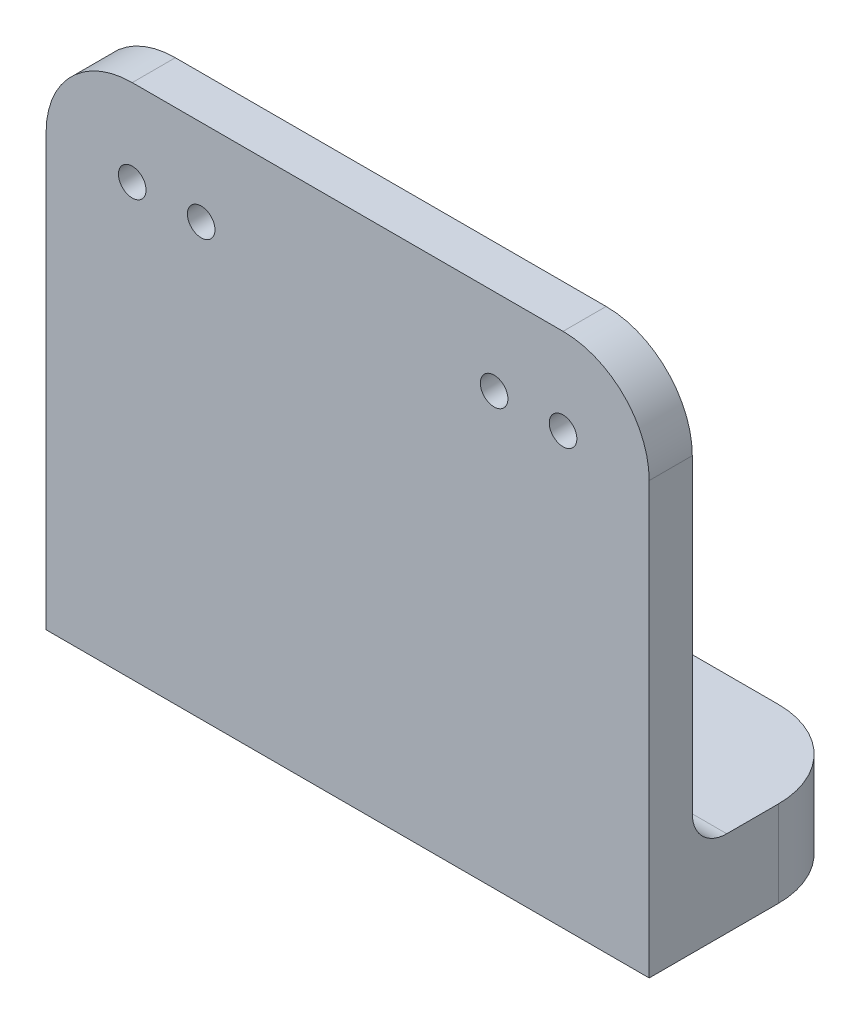
from build123d import *

# Parameters (mm, degrees)
SKETCH1_W           = 70
SKETCH1_H           = 25
SKETCH1_R           = 1.6
BOSS_EXTRUDE2_DEPTH = 10
SKETCH2_W           = 70
SKETCH2_H           = 5
BOSS_EXTRUDE3_DEPTH = 50
SKETCH3_R           = 3.5
CUT_EXTRUDE1_DEPTH  = 5
FILLET1_R           = 4
FILLET2_R           = 10
SKETCH4_R           = 1.6
CUT_EXTRUDE2_DEPTH  = 96.524865873


with BuildPart() as part:
    # Sketch1 → Boss-Extrude2 (new body)
    with BuildSketch(Plane(origin=(0, 0, 0), x_dir=(1, 0, 0), z_dir=(0, 1, 0))):
        with Locations((35, 12.5)):
            Rectangle(SKETCH1_W, SKETCH1_H)
        with Locations(Location((20, 15, 0), (0, 0, 270))):
            Circle(SKETCH1_R, mode=Mode.SUBTRACT)
        with Locations(Location((50, 15, 0), (0, 0, 270))):
            Circle(SKETCH1_R, mode=Mode.SUBTRACT)
    extrude(amount=BOSS_EXTRUDE2_DEPTH)

    # Sketch2 → Boss-Extrude3 (add)
    with BuildSketch(Plane(origin=(0, 10, 0), x_dir=(1, 0, 0), z_dir=(0, 1, 0))):
        with Locations((35, 2.5)):
            Rectangle(SKETCH2_W, SKETCH2_H)
    extrude(amount=BOSS_EXTRUDE3_DEPTH)

    # Sketch3 → Cut-Extrude1 (cut)
    with BuildSketch(Plane(origin=(0, 10, 0), x_dir=(1, 0, 0), z_dir=(0, 1, 0))):
        with Locations(Location((20, 15, 0), (0, 0, 270))):
            Circle(SKETCH3_R)
        with Locations(Location((50, 15, 0), (0, 0, 270))):
            Circle(SKETCH3_R)
    extrude(amount=-CUT_EXTRUDE1_DEPTH, mode=Mode.SUBTRACT)

    # Fillet1
    fillet1_edges = [part.edges().sort_by_distance(p)[0] for p in [
        (35, 10, -5),
    ]]
    fillet(fillet1_edges, radius=FILLET1_R)

    # Fillet2
    fillet2_edges = [part.edges().sort_by_distance(p)[0] for p in [
        (0, 60, -2.5),
        (70, 60, -2.5),
        (0, 5, -25),
        (70, 5, -25),
    ]]
    fillet(fillet2_edges, radius=FILLET2_R)

    # Sketch4 → Cut-Extrude2 (cut, through all)
    with BuildSketch(Plane.XY):
        with Locations((10, 50)):
            Circle(SKETCH4_R)
        with Locations((18, 50)):
            Circle(SKETCH4_R)
        with Locations((52, 50)):
            Circle(SKETCH4_R)
        with Locations((60, 50)):
            Circle(SKETCH4_R)
    extrude(amount=-CUT_EXTRUDE2_DEPTH, mode=Mode.SUBTRACT)


solid = part.part
